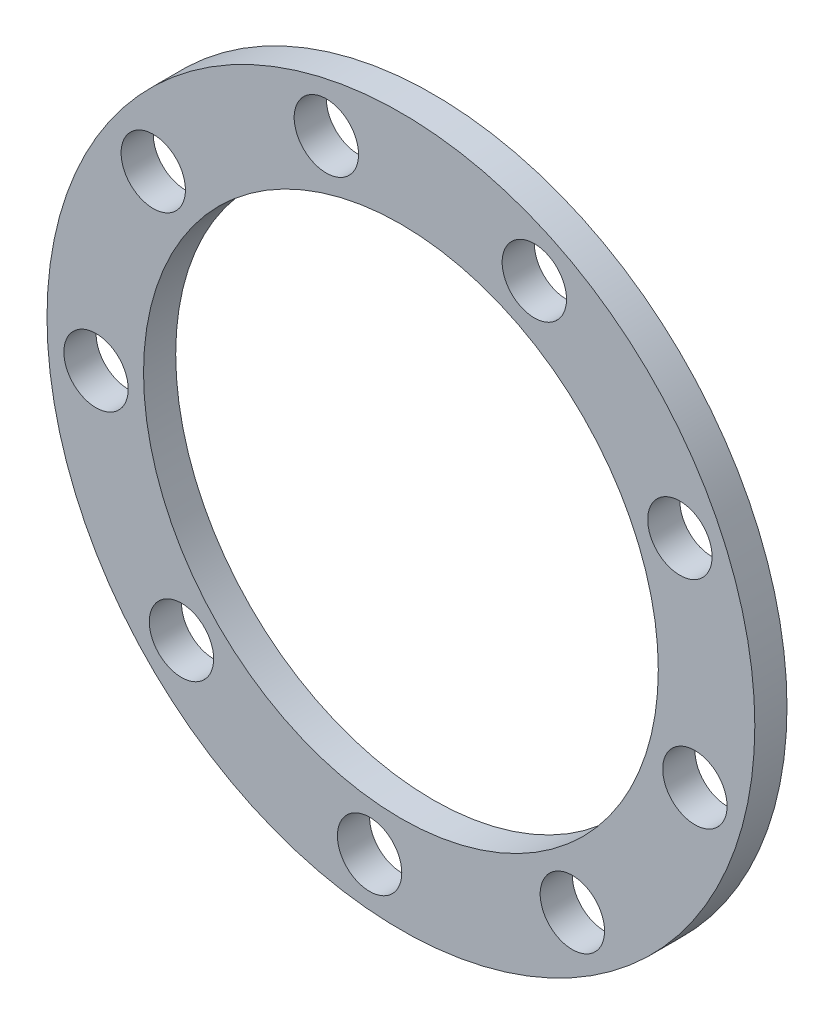
from build123d import *

# Parameters (mm, degrees)
SKETCH1_R           = 11
SKETCH1_R_2         = 8
SKETCH1_R_3         = 1
BOSS_EXTRUDE1_DEPTH = 1


with BuildPart() as part:
    # Sketch1 → Boss-Extrude1 (new body)
    with BuildSketch(Plane.XY):
        Circle(SKETCH1_R)
        Circle(SKETCH1_R_2, mode=Mode.SUBTRACT)
        with Locations((-2.317200388, 9.21306585)):
            Circle(SKETCH1_R_3, mode=Mode.SUBTRACT)
        with Locations((4.146966095, 8.547085597)):
            Circle(SKETCH1_R_3, mode=Mode.SUBTRACT)
        with Locations((8.670721054, 3.881829003)):
            Circle(SKETCH1_R_3, mode=Mode.SUBTRACT)
        with Locations((9.137349267, -2.599778524)):
            Circle(SKETCH1_R_3, mode=Mode.SUBTRACT)
        with Locations((5.328510208, -7.864920786)):
            Circle(SKETCH1_R_3, mode=Mode.SUBTRACT)
        with Locations((-0.973597997, -9.449979203)):
            Circle(SKETCH1_R_3, mode=Mode.SUBTRACT)
        with Locations((-6.820148879, -6.613287327)):
            Circle(SKETCH1_R_3, mode=Mode.SUBTRACT)
        with Locations((-9.475476303, -0.682164812)):
            Circle(SKETCH1_R_3, mode=Mode.SUBTRACT)
        with Locations((-7.697123057, 5.5681502)):
            Circle(SKETCH1_R_3, mode=Mode.SUBTRACT)
    extrude(amount=BOSS_EXTRUDE1_DEPTH)


solid = part.part
